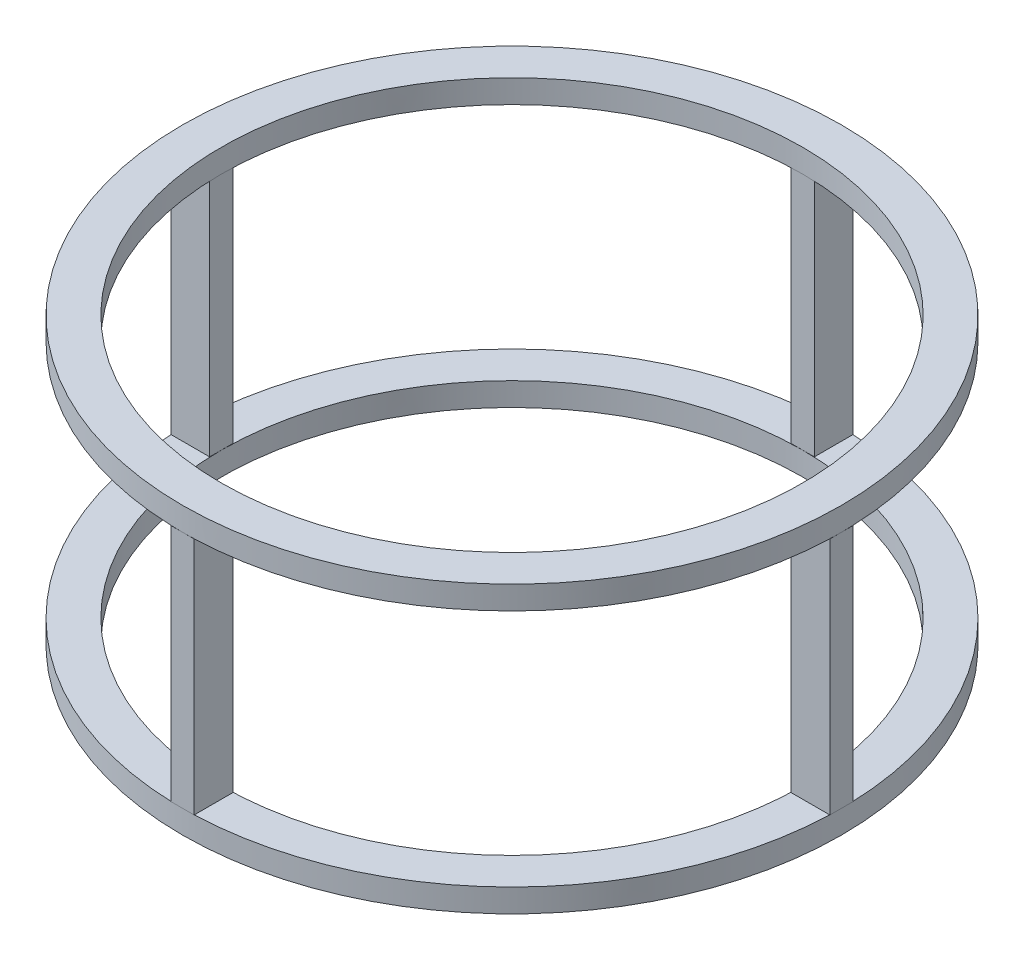
from build123d import *

# Parameters (mm, degrees)
SKETCH1_R           = 53.975
SKETCH1_R_2         = 47.625
BOSS_EXTRUDE1_DEPTH = 3.81
SKETCH2_R           = 53.975
SKETCH2_R_2         = 47.625
BOSS_EXTRUDE2_DEPTH = 3.81
SKETCH4_W           = 6.35
SKETCH4_H           = 39.15918
BOSS_EXTRUDE3_DEPTH = 1.905
CIRPATTERN1_COUNT   = 4


with BuildPart() as part:
    # Sketch1 → Boss-Extrude1 (new body)
    with BuildSketch(Plane(origin=(0, 0, 0), x_dir=(1, 0, 0), z_dir=(0, 1, 0))):
        with Locations(Location((0, 0, 0), (0, 0, 90))):
            Circle(SKETCH1_R)
        with Locations(Location((0, 0, 0), (0, 0, 90))):
            Circle(SKETCH1_R_2, mode=Mode.SUBTRACT)
    extrude(amount=BOSS_EXTRUDE1_DEPTH)



with BuildPart() as body_2:
    # Sketch2 → Boss-Extrude2 (new body)
    with BuildSketch(Plane(origin=(0, 42.96918, 0), x_dir=(1, 0, 0), z_dir=(0, 1, 0))):
        with Locations(Location((0, 0, 0), (0, 0, 90))):
            Circle(SKETCH2_R)
        with Locations(Location((0, 0, 0), (0, 0, 90))):
            Circle(SKETCH2_R_2, mode=Mode.SUBTRACT)
    extrude(amount=BOSS_EXTRUDE2_DEPTH)


with BuildPart() as part_1:
    add(part.part)

    add(body_2.part)  # Boss-Extrude3 merges body 2
    # Sketch4 → Boss-Extrude3 (add, symmetric)
    with BuildSketch(Plane(origin=(0, 0, 0), x_dir=(0, 0, -1), z_dir=(1, 0, 0))):
        with Locations((-50.8, 23.38959)):
            Rectangle(SKETCH4_W, SKETCH4_H)
    boss_extrude3 = extrude(amount=BOSS_EXTRUDE3_DEPTH, both=True)

    # CirPattern1: Boss-Extrude3 ×4 about axis
    cirpattern1_axis = Axis((0, 0, 0), (0, 1, 0))
    for i in range(1, CIRPATTERN1_COUNT):
        add(boss_extrude3.rotate(cirpattern1_axis, i * 360 / CIRPATTERN1_COUNT))


solid = part_1.part
